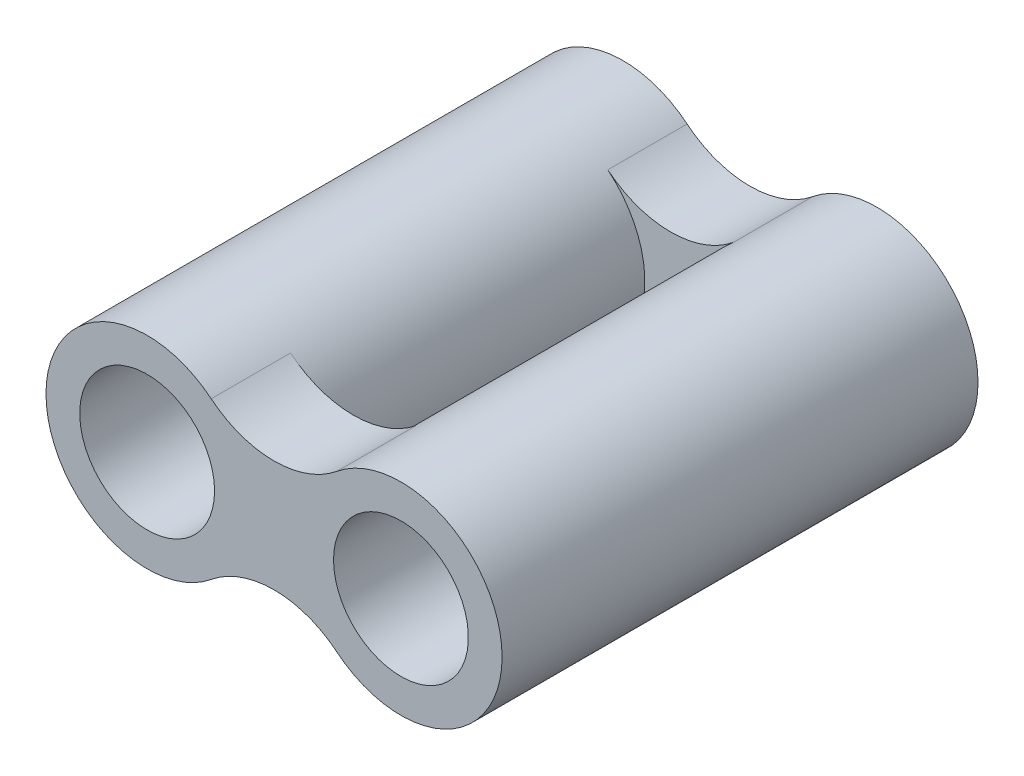
from build123d import *

# Parameters (mm, degrees)
CROQUIS1_R              = 1.7
SALIENTE_EXTRUIR1_DEPTH = 2
CROQUIS2_R              = 2.55
CROQUIS2_R_2            = 1.7
SALIENTE_EXTRUIR2_DEPTH = 8


with BuildPart() as part:
    # Croquis1 → Saliente-Extruir1 (new body)
    with BuildSketch(Plane.XY):
        with BuildLine():
            ThreePointArc((-1.584158416, 1.972702708), (-5.75, 0), (-1.584158416, -1.972702708))
            ThreePointArc((-1.584158416, -1.972702708), (0, -1.406724971), (1.584158416, -1.972702708))
            ThreePointArc((1.584158416, -1.972702708), (5.75, 0), (1.584158416, 1.972702708))
            ThreePointArc((1.584158416, 1.972702708), (0, 1.406724971), (-1.584158416, 1.972702708))
        make_face()
        with Locations((-3.2, 0)):
            Circle(CROQUIS1_R, mode=Mode.SUBTRACT)
        with Locations(Location((3.2, 0, 0), (0, 0, 180))):
            Circle(CROQUIS1_R, mode=Mode.SUBTRACT)
    saliente_extruir1 = extrude(amount=SALIENTE_EXTRUIR1_DEPTH)

    # Croquis2 → Saliente-Extruir2 (add)
    # profile 1 of 2: a face of its own
    with BuildSketch(Plane.XY.offset(2)):
        with Locations(Location((-3.2, 0, 0), (0, 0, 309.320919198))):
            Circle(CROQUIS2_R)
        with Locations((-3.2, 0)):
            Circle(CROQUIS2_R_2, mode=Mode.SUBTRACT)
    # profile 2 of 2: a face of its own
    with BuildSketch(Plane.XY.offset(2)):
        with Locations(Location((3.2, 0, 0), (0, 0, 129.320919198))):
            Circle(CROQUIS2_R)
        with Locations(Location((3.2, 0, 0), (0, 0, 180))):
            Circle(CROQUIS2_R_2, mode=Mode.SUBTRACT)
    extrude(amount=SALIENTE_EXTRUIR2_DEPTH)

    # Simetría1: Saliente-Extruir1 across plane
    add(saliente_extruir1.mirror(Plane.XY.offset(6)))


solid = part.part
